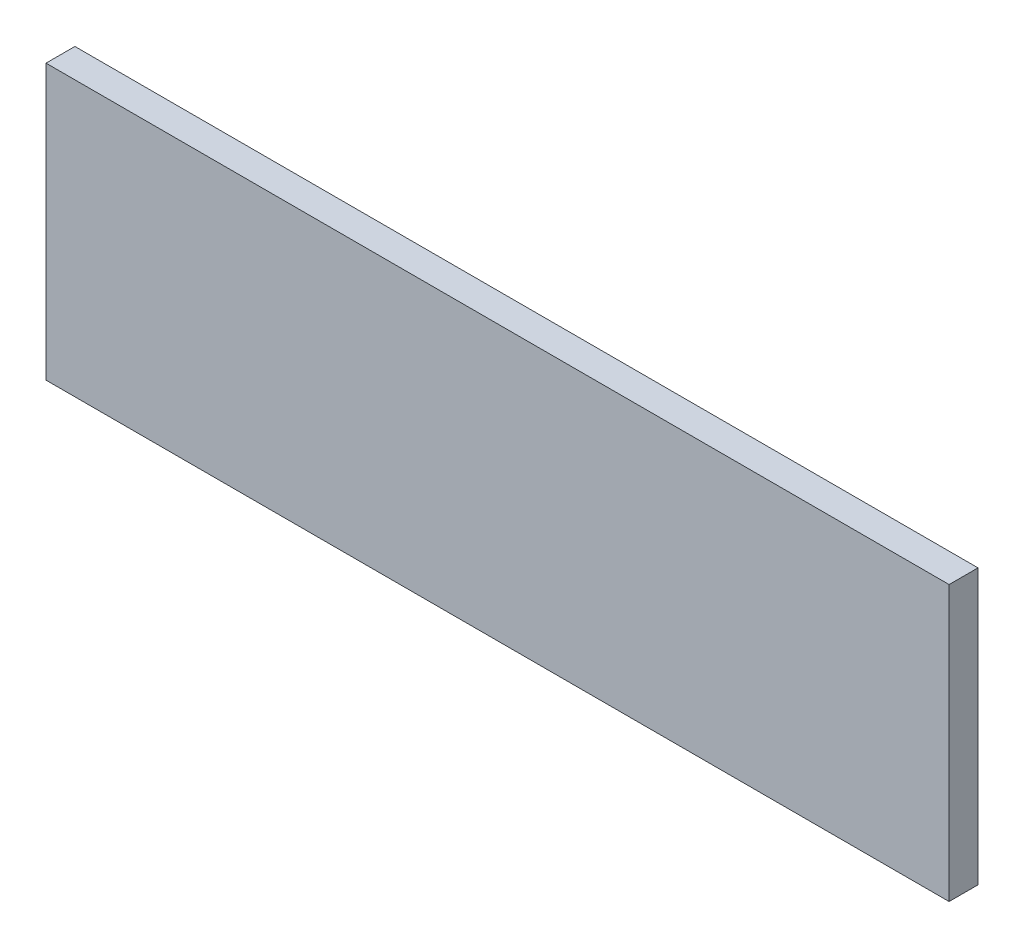
from build123d import *

# Parameters (mm, degrees)
SKETCH1_W           = 250
SKETCH1_H           = 76
BOSS_EXTRUDE1_DEPTH = 8


with BuildPart() as part:
    # Sketch1 → Boss-Extrude1 (new body)
    with BuildSketch(Plane.XY):
        Rectangle(SKETCH1_W, SKETCH1_H)
    extrude(amount=BOSS_EXTRUDE1_DEPTH)


solid = part.part
